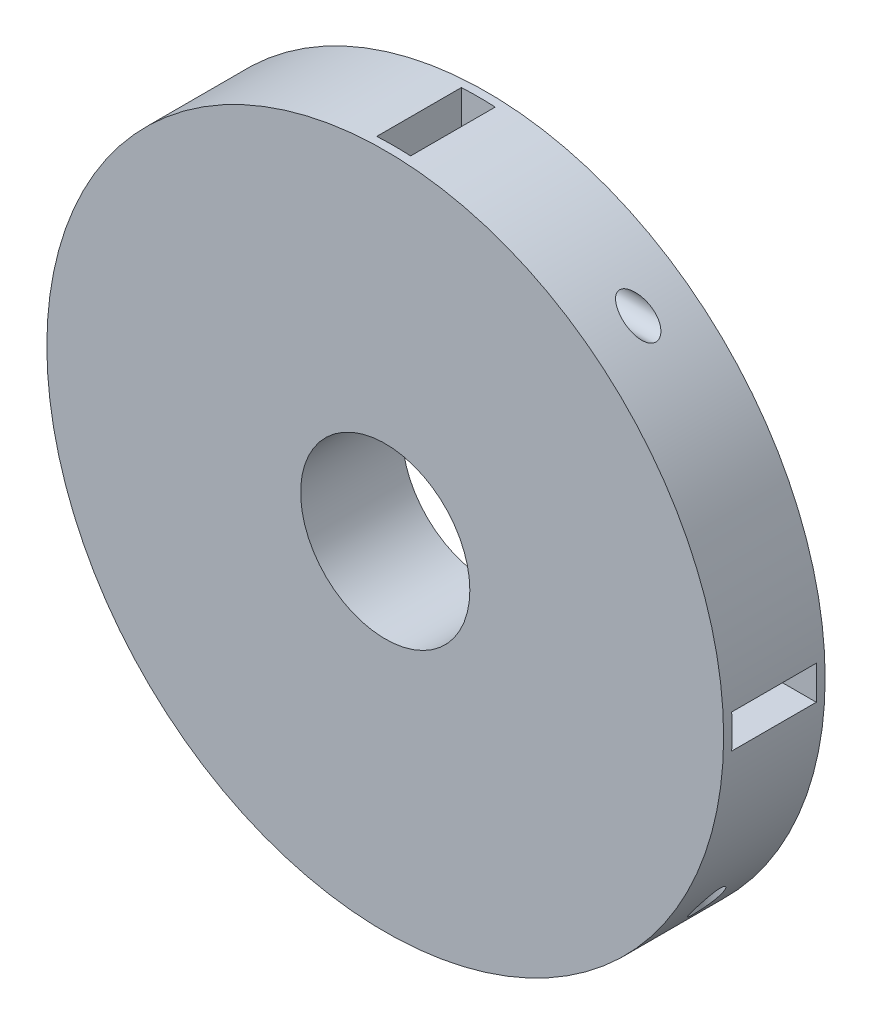
from build123d import *

# Parameters (mm, degrees)
SKETCH1_R               = 100
SKETCH1_R_2             = 25
BOSS_EXTRUDE1_DEPTH     = 15
CUT_EXTRUDE1_DEPTH      = 12.5
CUT_EXTRUDE2_DEPTH      = 25
CUT_EXTRUDE2_DEPTH_BACK = 100
SKETCH3_R               = 4
CUT_EXTRUDE3_DEPTH      = 100
CUT_EXTRUDE3_DEPTH_BACK = 25
SKETCH4_R               = 4
CUT_EXTRUDE4_DEPTH      = 25
CUT_EXTRUDE4_DEPTH_BACK = 100
SKETCH5_R               = 4
CUT_EXTRUDE5_DEPTH      = 100
CUT_EXTRUDE5_DEPTH_BACK = 25
SKETCH6_R               = 4


with BuildPart() as part:
    # Sketch1 → Boss-Extrude1 (new, symmetric)
    with BuildSketch(Plane.XY):
        Circle(SKETCH1_R)
        Circle(SKETCH1_R_2, mode=Mode.SUBTRACT)
    extrude(amount=BOSS_EXTRUDE1_DEPTH, both=True)

    # Sketch2 → Cut-Extrude1 (cut, symmetric)
    with BuildSketch(Plane.XY):
        Polygon((60, -5), (110, -5), (100, 5), (60, 5), align=None)
        Polygon((-5, -60), (-5, -110), (5, -100), (5, -60), align=None)
        Polygon((-60, 5), (-110, 5), (-100, -5), (-60, -5), align=None)
        Polygon((5, 60), (5, 110), (-5, 100), (-5, 60), align=None)
    extrude(amount=CUT_EXTRUDE1_DEPTH, both=True, mode=Mode.SUBTRACT)

    # Sketch3 → Cut-Extrude2 (cut, two sides: drawn at the far end of the back side and taken through both)
    with BuildSketch(Plane(origin=(0, 0, 0), x_dir=(1, 0, 0), z_dir=(0, 1, 0)).offset(-CUT_EXTRUDE2_DEPTH_BACK)):
        with Locations(Location((80, 0, 0), (0, 0, 90))):
            Circle(SKETCH3_R)
    extrude(amount=CUT_EXTRUDE2_DEPTH + CUT_EXTRUDE2_DEPTH_BACK, mode=Mode.SUBTRACT)

    # Sketch4 → Cut-Extrude3 (cut, two sides: drawn at the far end of the back side and taken through both)
    with BuildSketch(Plane(origin=(0, 0, 0), x_dir=(0, 0, -1), z_dir=(1, 0, 0)).offset(-CUT_EXTRUDE3_DEPTH_BACK)):
        with Locations(Location((0, 80, 0), (0, 0, 180))):
            Circle(SKETCH4_R)
    extrude(amount=CUT_EXTRUDE3_DEPTH + CUT_EXTRUDE3_DEPTH_BACK, mode=Mode.SUBTRACT)

    # Sketch5 → Cut-Extrude4 (cut, two sides: drawn at the far end of the back side and taken through both)
    with BuildSketch(Plane(origin=(0, 0, 0), x_dir=(0, 0, -1), z_dir=(1, 0, 0)).offset(-CUT_EXTRUDE4_DEPTH_BACK)):
        with Locations(Location((0, -80, 0), (0, 0, 180))):
            Circle(SKETCH5_R)
    extrude(amount=CUT_EXTRUDE4_DEPTH + CUT_EXTRUDE4_DEPTH_BACK, mode=Mode.SUBTRACT)

    # Sketch6 → Cut-Extrude5 (cut, two sides: drawn at the far end of the back side and taken through both)
    with BuildSketch(Plane(origin=(0, 0, 0), x_dir=(1, 0, 0), z_dir=(0, 1, 0)).offset(-CUT_EXTRUDE5_DEPTH_BACK)):
        with Locations(Location((-80, 0, 0), (0, 0, 90))):
            Circle(SKETCH6_R)
    extrude(amount=CUT_EXTRUDE5_DEPTH + CUT_EXTRUDE5_DEPTH_BACK, mode=Mode.SUBTRACT)


solid = part.part
